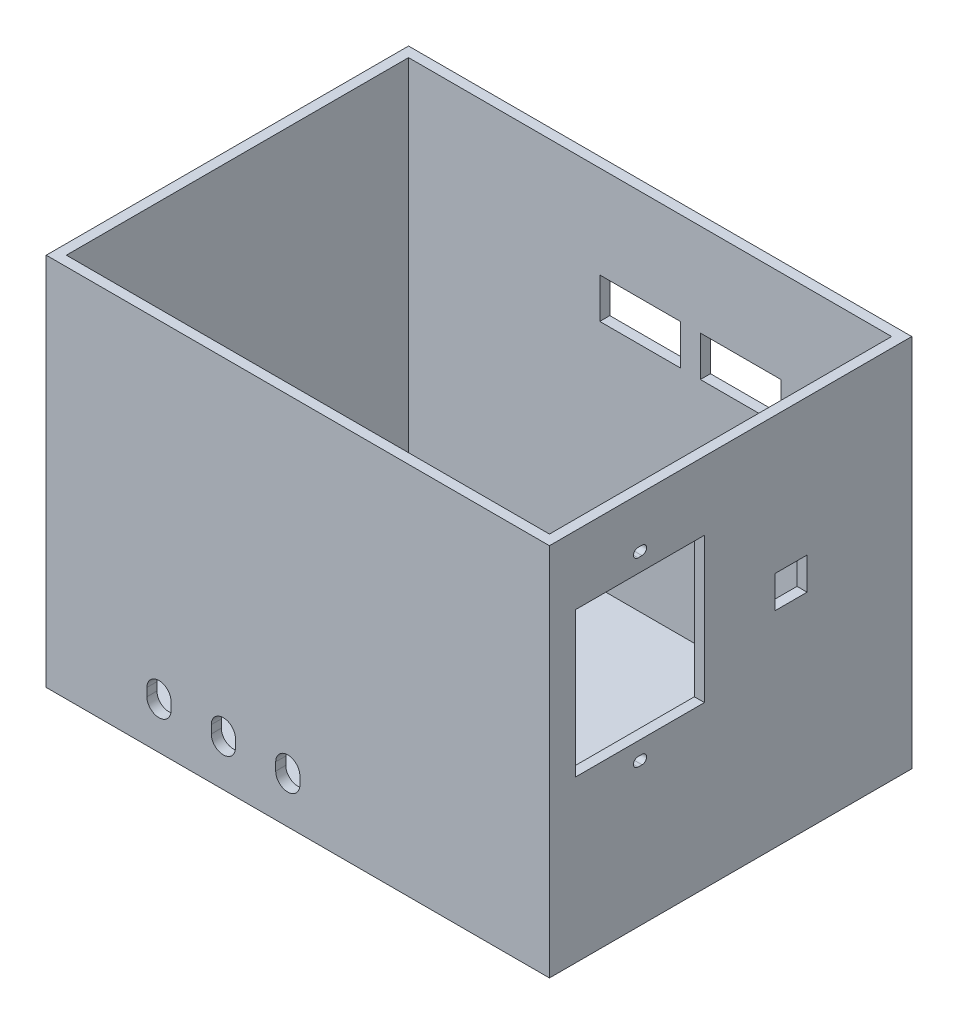
from build123d import *

# Parameters (mm, degrees)
SKETCH1_W           = 125
SKETCH1_H           = 90
BOSS_EXTRUDE1_DEPTH = 2.5
SKETCH1_3_W         = 125
SKETCH1_3_H         = 90
SKETCH1_3_W_2       = 120
SKETCH1_3_H_2       = 85
BOSS_EXTRUDE2_DEPTH = 93
SKETCH2_W           = 32
SKETCH2_H           = 36
CUT_EXTRUDE1_DEPTH  = 5
CUT_EXTRUDE2_DEPTH  = 10
SKETCH6_W           = 8
SKETCH6_H           = 8
CUT_EXTRUDE3_DEPTH  = 10
SKETCH7_W           = 20
SKETCH7_H           = 10
CUT_EXTRUDE4_DEPTH  = 10


with BuildPart() as part:
    # Sketch1 → Boss-Extrude1 (new body)
    with BuildSketch(Plane(origin=(0, 0, 0), x_dir=(1, 0, 0), z_dir=(0, 1, 0))):
        Rectangle(SKETCH1_W, SKETCH1_H)
    extrude(amount=BOSS_EXTRUDE1_DEPTH)

    # Sketch1<3> → Boss-Extrude2 (add)
    with BuildSketch(Plane(origin=(0, 0, 0), x_dir=(1, 0, 0), z_dir=(0, 1, 0))):
        Rectangle(SKETCH1_3_W, SKETCH1_3_H)
        Rectangle(SKETCH1_3_W_2, SKETCH1_3_H_2, mode=Mode.SUBTRACT)
    extrude(amount=BOSS_EXTRUDE2_DEPTH)

    # Sketch2 → Cut-Extrude1 (cut)
    with BuildSketch(Plane(origin=(62.5, 0, 0), x_dir=(0, 0, -1), z_dir=(1, 0, 0))):
        with Locations((-22.5, 58)):
            Rectangle(SKETCH2_W, SKETCH2_H)
        with BuildLine():
            Line((-23, 81.625), (-22, 81.625))
            ThreePointArc((-22, 81.625), (-20.875, 80.5), (-22, 79.375))
            Line((-22, 79.375), (-23, 79.375))
            ThreePointArc((-23, 79.375), (-24.125, 80.5), (-23, 81.625))
        make_face()
        with BuildLine():
            Line((-23, 34.375), (-22, 34.375))
            ThreePointArc((-22, 34.375), (-20.875, 35.5), (-22, 36.625))
            Line((-22, 36.625), (-23, 36.625))
            ThreePointArc((-23, 36.625), (-24.125, 35.5), (-23, 34.375))
        make_face()
    extrude(amount=-CUT_EXTRUDE1_DEPTH, mode=Mode.SUBTRACT)

    # Sketch5 → Cut-Extrude2 (cut)
    with BuildSketch(Plane.XY.offset(45)):
        with BuildLine():
            Line((-37.5, 10.5), (-37.5, 12.5))
            ThreePointArc((-37.5, 12.5), (-34.5, 15.5), (-31.5, 12.5))
            Line((-31.5, 12.5), (-31.5, 10.5))
            ThreePointArc((-31.5, 10.5), (-34.5, 7.5), (-37.5, 10.5))
        make_face()
        with BuildLine():
            Line((-21.5, 10.5), (-21.5, 12.5))
            ThreePointArc((-21.5, 12.5), (-18.5, 15.5), (-15.5, 12.5))
            Line((-15.5, 12.5), (-15.5, 10.5))
            ThreePointArc((-15.5, 10.5), (-18.5, 7.5), (-21.5, 10.5))
        make_face()
        with BuildLine():
            Line((-5.5, 10.5), (-5.5, 12.5))
            ThreePointArc((-5.5, 12.5), (-2.5, 15.5), (0.5, 12.5))
            Line((0.5, 12.5), (0.5, 10.5))
            ThreePointArc((0.5, 10.5), (-2.5, 7.5), (-5.5, 10.5))
        make_face()
    extrude(amount=-CUT_EXTRUDE2_DEPTH, mode=Mode.SUBTRACT)

    # Sketch6 → Cut-Extrude3 (cut)
    with BuildSketch(Plane(origin=(62.5, 0, 0), x_dir=(0, 0, -1), z_dir=(1, 0, 0))):
        with Locations((15, 55)):
            Rectangle(SKETCH6_W, SKETCH6_H)
    extrude(amount=-CUT_EXTRUDE3_DEPTH, mode=Mode.SUBTRACT)

    # Sketch7 → Cut-Extrude4 (cut)
    with BuildSketch(Plane(origin=(0, 0, -45), x_dir=(-1, 0, 0), z_dir=(0, 0, -1))):
        with Locations((-22.5, 65)):
            Rectangle(SKETCH7_W, SKETCH7_H)
        with Locations((2.5, 65)):
            Rectangle(SKETCH7_W, SKETCH7_H)
    extrude(amount=-CUT_EXTRUDE4_DEPTH, mode=Mode.SUBTRACT)


solid = part.part
